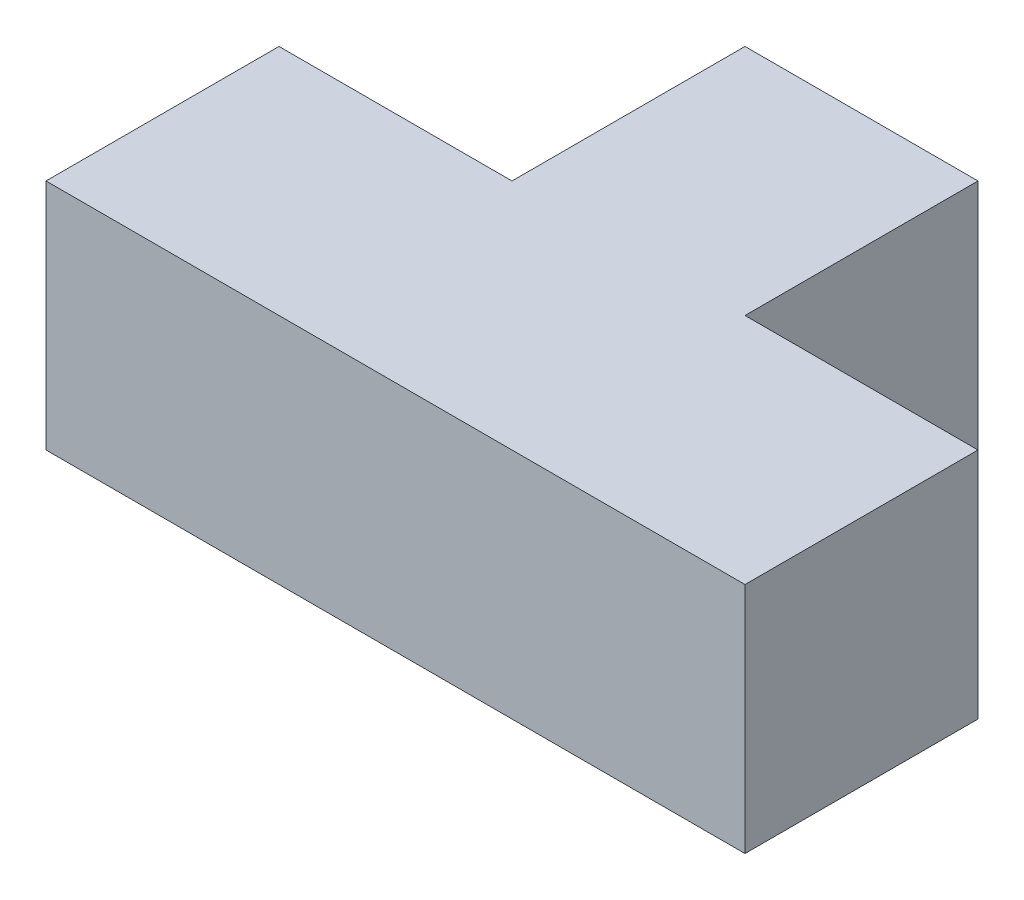
from build123d import *

# Parameters (mm, degrees)
BOSS_EXTRUDE1_DEPTH = 30


with BuildPart() as part:
    # Sketch1 → Boss-Extrude1 (new body)
    with BuildSketch(Plane(origin=(0, 0, 0), x_dir=(1, 0, 0), z_dir=(0, 1, 0))):
        Polygon((-30, 0), (60, 0), (60, 30), (30, 30), (30, 60), (0, 60), (0, 30), (-30, 30), align=None)
    extrude(amount=BOSS_EXTRUDE1_DEPTH)


solid = part.part
